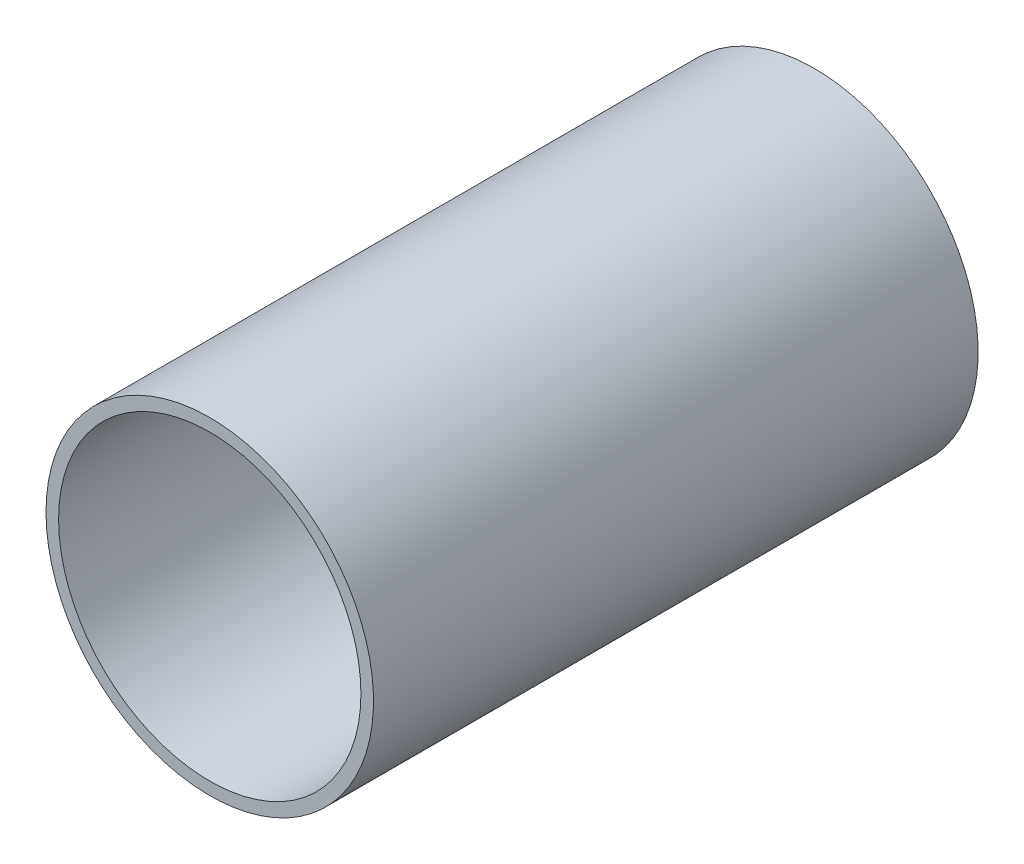
from build123d import *

# Parameters (mm, degrees)
SKETCH1_R           = 82.55
SKETCH1_R_2         = 76.2
EXTRUDE_THIN1_DEPTH = 152.4


with BuildPart() as part:
    # Sketch1 → Extrude-Thin1 (new, symmetric)
    with BuildSketch(Plane.XY):
        Circle(SKETCH1_R)
        Circle(SKETCH1_R_2, mode=Mode.SUBTRACT)
    extrude(amount=EXTRUDE_THIN1_DEPTH, both=True)


solid = part.part
